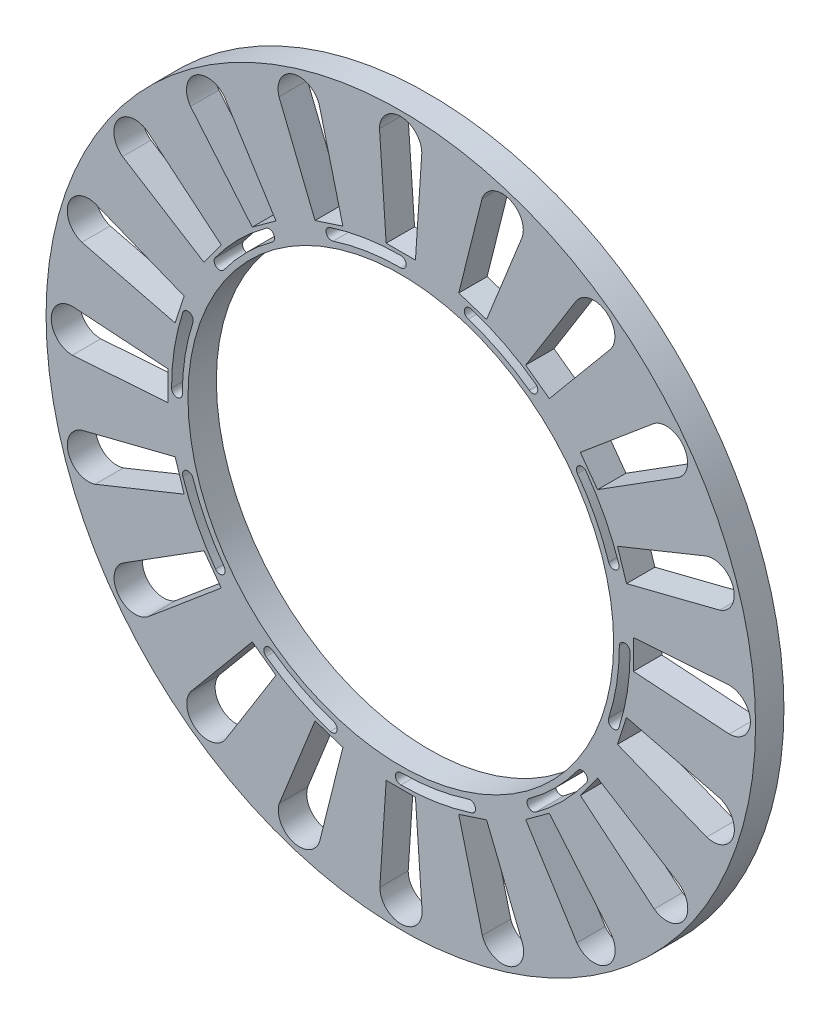
from build123d import *

# Parameters (mm, degrees)
SKETCH1_R           = 25
BOSS_EXTRUDE1_DEPTH = 2
SKETCH2_R           = 15
CUT_EXTRUDE1_DEPTH  = 5
CUT_EXTRUDE4_DEPTH  = 10
CIRPATTERN3_COUNT   = 20
CUT_EXTRUDE5_DEPTH  = 10
CIRPATTERN4_COUNT   = 10


with BuildPart() as part:
    # Sketch1 → Boss-Extrude1 (new body)
    with BuildSketch(Plane.XY):
        Circle(SKETCH1_R)
    extrude(amount=BOSS_EXTRUDE1_DEPTH)

    # Sketch2 → Cut-Extrude1 (cut)
    with BuildSketch(Plane(origin=(0, 0, 0), x_dir=(-1, 0, 0), z_dir=(0, 0, -1))):
        Circle(SKETCH2_R)
    extrude(amount=-CUT_EXTRUDE1_DEPTH, mode=Mode.SUBTRACT)

    # Sketch8 → Cut-Extrude4 (cut)
    with BuildSketch(Plane.XY.offset(2)):
        with BuildLine():
            Line((-1.502861851, 23.143578335), (-1.0312505, 16.38824879))
            Line((-1.0312505, 16.38824879), (1.0312505, 16.38824879))
            Line((1.0312505, 16.38824879), (1.478722794, 23.143578335))
            ThreePointArc((1.478722794, 23.143578335), (-0.012069528, 24.634370658), (-1.502861851, 23.143578335))
        make_face()
    cut_extrude4 = extrude(amount=-CUT_EXTRUDE4_DEPTH, mode=Mode.SUBTRACT)

    # CirPattern3: Cut-Extrude4 ×20 about axis
    cirpattern3_axis = Axis((0, 0, 0), (0, 0, 1))
    for i in range(1, CIRPATTERN3_COUNT):
        add(cut_extrude4.rotate(cirpattern3_axis, i * 360 / CIRPATTERN3_COUNT), mode=Mode.SUBTRACT)

    # Sketch9 → Cut-Extrude5 (cut)
    with BuildSketch(Plane.XY.offset(2)):
        with BuildLine():
            ThreePointArc((0, 16.155710659), (-2.535802961, 15.955459574), (-5.008743036, 15.359670572))
            ThreePointArc((-5.008743036, 15.359670572), (-5.251126101, 14.882712493), (-4.774168022, 14.640329428))
            ThreePointArc((-4.774168022, 14.640329428), (-2.417043421, 15.208215778), (0, 15.399088481))
            ThreePointArc((0, 15.399088481), (0.378311089, 15.77739957), (0, 16.155710659))
        make_face()
    cut_extrude5 = extrude(amount=-CUT_EXTRUDE5_DEPTH, mode=Mode.SUBTRACT)

    # CirPattern4: Cut-Extrude5 ×10 about axis
    cirpattern4_axis = Axis((0, 0, 0), (0, 0, 1))
    for i in range(1, CIRPATTERN4_COUNT):
        add(cut_extrude5.rotate(cirpattern4_axis, i * 360 / CIRPATTERN4_COUNT), mode=Mode.SUBTRACT)


solid = part.part
